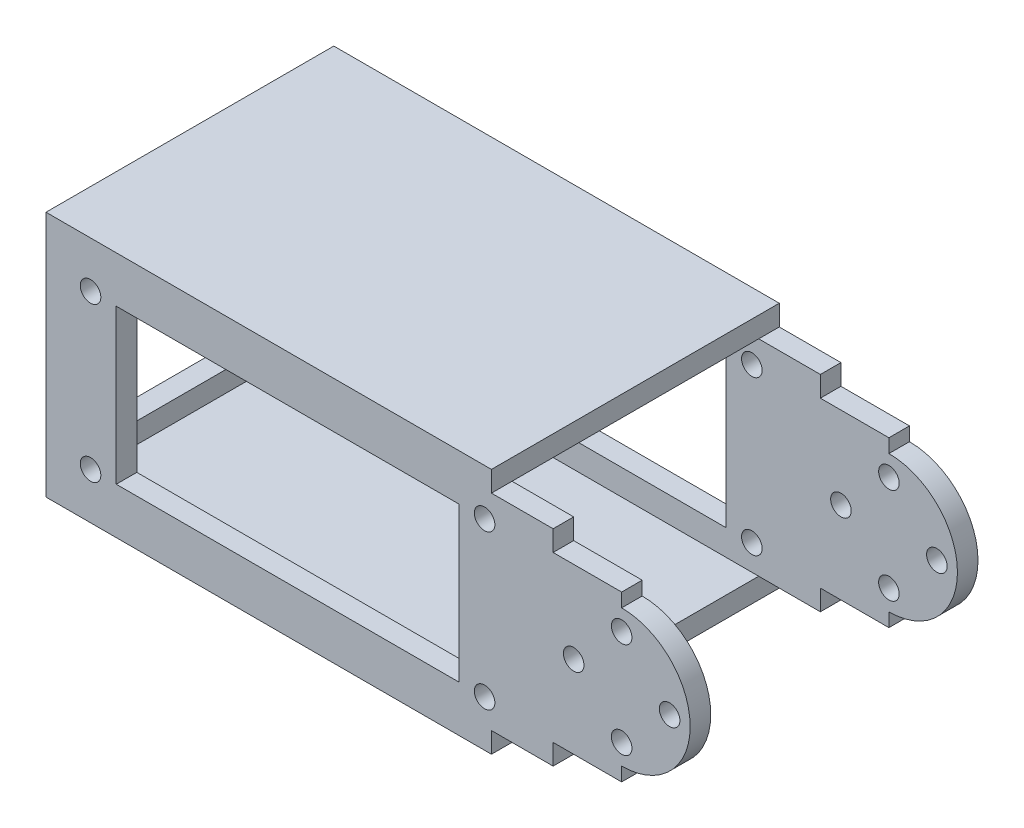
from build123d import *

# Parameters (mm, degrees)
SKETCH1_R           = 1.5
SKETCH1_W           = 50
SKETCH1_H           = 22.5
BOSS_EXTRUDE2_DEPTH = 3
SKETCH2_W           = 42
SKETCH2_H           = 30
BOSS_EXTRUDE3_DEPTH = 3
BOSS_EXTRUDE4_START = 39
SKETCH1_2_R         = 1.5
SKETCH1_2_W         = 50
SKETCH1_2_H         = 22.5
BOSS_EXTRUDE4_DEPTH = 3
SKETCH4_W           = 36
SKETCH4_H           = 24
CUT_EXTRUDE1_DEPTH  = 3
SKETCH5_W           = 65
SKETCH5_H           = 42
BOSS_EXTRUDE5_DEPTH = 3
SKETCH6_W           = 65
SKETCH6_H           = 42
BOSS_EXTRUDE6_DEPTH = 3


with BuildPart() as part:
    # Sketch1 → Boss-Extrude2 (new body)
    with BuildSketch(Plane.XY):
        with BuildLine():
            Line((0, 10), (0, 12))
            Line((0, 12), (-10, 12))
            Line((-10, 12), (-10, 15))
            Line((-10, 15), (-81, 15))
            Line((-81, 15), (-81, -15))
            Line((-81, -15), (-10, -15))
            Line((-10, -15), (-10, -12))
            Line((-10, -12), (0, -12))
            Line((0, -12), (0, -10))
            ThreePointArc((0, -10), (10, 0), (0, 10))
        make_face()
        with Locations((0, 7)):
            Circle(SKETCH1_R, mode=Mode.SUBTRACT)
        with Locations((7, 0)):
            Circle(SKETCH1_R, mode=Mode.SUBTRACT)
        with Locations((0, -7)):
            Circle(SKETCH1_R, mode=Mode.SUBTRACT)
        with Locations((-7, 0)):
            Circle(SKETCH1_R, mode=Mode.SUBTRACT)
        with Locations((-20, 11.25)):
            Circle(SKETCH1_R, mode=Mode.SUBTRACT)
        with Locations((-20, -11.25)):
            Circle(SKETCH1_R, mode=Mode.SUBTRACT)
        with Locations((-77.5, 11.25)):
            Circle(SKETCH1_R, mode=Mode.SUBTRACT)
        with Locations((-77.5, -11.25)):
            Circle(SKETCH1_R, mode=Mode.SUBTRACT)
        with Locations((-48.75, 0)):
            Rectangle(SKETCH1_W, SKETCH1_H, mode=Mode.SUBTRACT)
    extrude(amount=BOSS_EXTRUDE2_DEPTH)

    # Sketch2 → Boss-Extrude3 (add)
    with BuildSketch(Plane.ZY.offset(81)):
        with Locations((21, 0)):
            Rectangle(SKETCH2_W, SKETCH2_H)
    extrude(amount=BOSS_EXTRUDE3_DEPTH)

    # Sketch1<2> → Boss-Extrude4 (add)
    with BuildSketch(Plane.XY.offset(BOSS_EXTRUDE4_START)):
        with BuildLine():
            Line((0, 10), (0, 12))
            Line((0, 12), (-10, 12))
            Line((-10, 12), (-10, 15))
            Line((-10, 15), (-81, 15))
            Line((-81, 15), (-81, -15))
            Line((-81, -15), (-10, -15))
            Line((-10, -15), (-10, -12))
            Line((-10, -12), (0, -12))
            Line((0, -12), (0, -10))
            ThreePointArc((0, -10), (10, 0), (0, 10))
        make_face()
        with Locations((0, 7)):
            Circle(SKETCH1_2_R, mode=Mode.SUBTRACT)
        with Locations((7, 0)):
            Circle(SKETCH1_2_R, mode=Mode.SUBTRACT)
        with Locations((0, -7)):
            Circle(SKETCH1_2_R, mode=Mode.SUBTRACT)
        with Locations((-7, 0)):
            Circle(SKETCH1_2_R, mode=Mode.SUBTRACT)
        with Locations((-20, 11.25)):
            Circle(SKETCH1_2_R, mode=Mode.SUBTRACT)
        with Locations((-20, -11.25)):
            Circle(SKETCH1_2_R, mode=Mode.SUBTRACT)
        with Locations((-77.5, 11.25)):
            Circle(SKETCH1_2_R, mode=Mode.SUBTRACT)
        with Locations((-77.5, -11.25)):
            Circle(SKETCH1_2_R, mode=Mode.SUBTRACT)
        with Locations((-48.75, 0)):
            Rectangle(SKETCH1_2_W, SKETCH1_2_H, mode=Mode.SUBTRACT)
    extrude(amount=BOSS_EXTRUDE4_DEPTH)

    # Sketch4 → Cut-Extrude1 (cut)
    with BuildSketch(Plane.ZY.offset(84)):
        with Locations((21, 0)):
            Rectangle(SKETCH4_W, SKETCH4_H)
    extrude(amount=-CUT_EXTRUDE1_DEPTH, mode=Mode.SUBTRACT)

    # Sketch5 → Boss-Extrude5 (add)
    with BuildSketch(Plane(origin=(0, 15, 0), x_dir=(1, 0, 0), z_dir=(0, 1, 0))):
        with Locations((-51.5, -21)):
            Rectangle(SKETCH5_W, SKETCH5_H)
    extrude(amount=BOSS_EXTRUDE5_DEPTH)

    # Sketch6 → Boss-Extrude6 (add)
    with BuildSketch(Plane.XZ.offset(15)):
        with Locations((-51.5, 21)):
            Rectangle(SKETCH6_W, SKETCH6_H)
    extrude(amount=BOSS_EXTRUDE6_DEPTH)


solid = part.part
